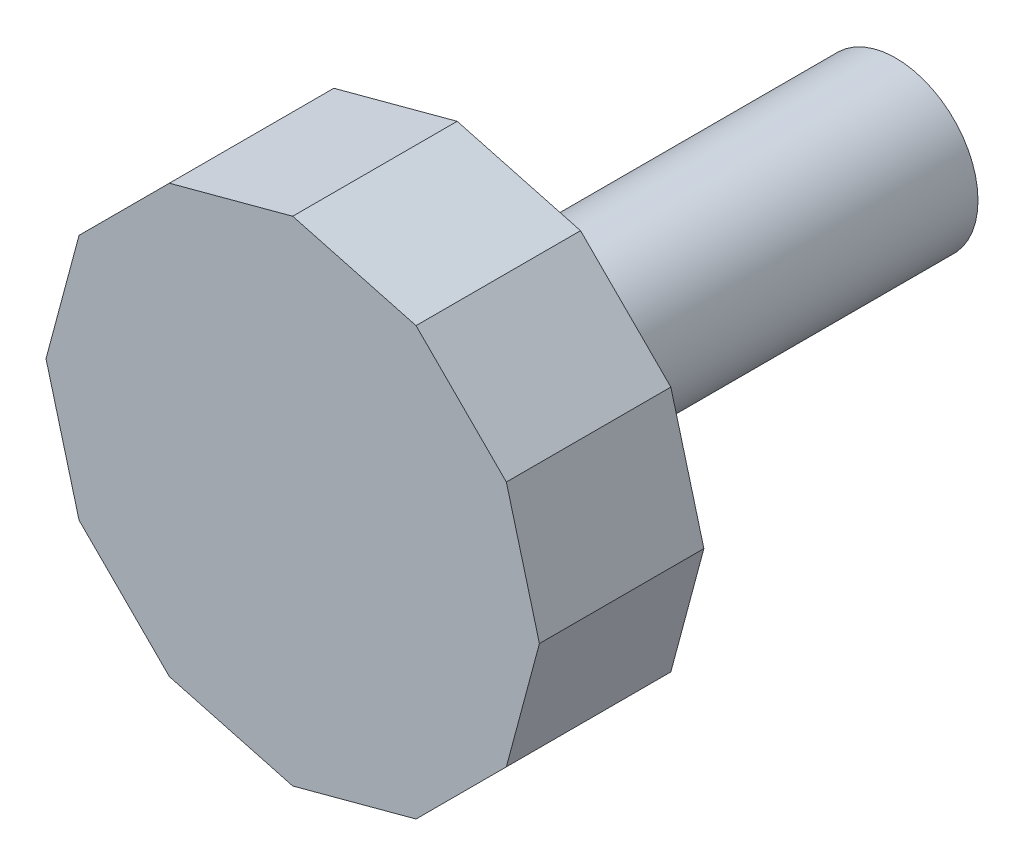
from build123d import *

# Parameters (mm, degrees)
SKETCH_1_R       = 1.5
M3X8_DEPTH       = 8
EXTRUDE_START    = 8
EXTRUDE_D9_DEPTH = 3


with BuildPart() as part:
    # 草图1 → M3x8简化螺杆 (new body)
    with BuildSketch(Plane.XY):
        Circle(SKETCH_1_R)
    extrude(amount=M3X8_DEPTH)

    # 草图2 → D9十二边手拧头 (add)
    with BuildSketch(Plane.XY.offset(EXTRUDE_START)):
        Polygon((4.5, 0), (3.897114317, 2.25), (2.25, 3.897114317), (0, 4.5), (-2.25, 3.897114317), (-3.897114317, 2.25), (-4.5, 0), (-3.897114317, -2.25), (-2.25, -3.897114317), (0, -4.5), (2.25, -3.897114317), (3.897114317, -2.25), align=None)
    extrude(amount=EXTRUDE_D9_DEPTH)


solid = part.part
